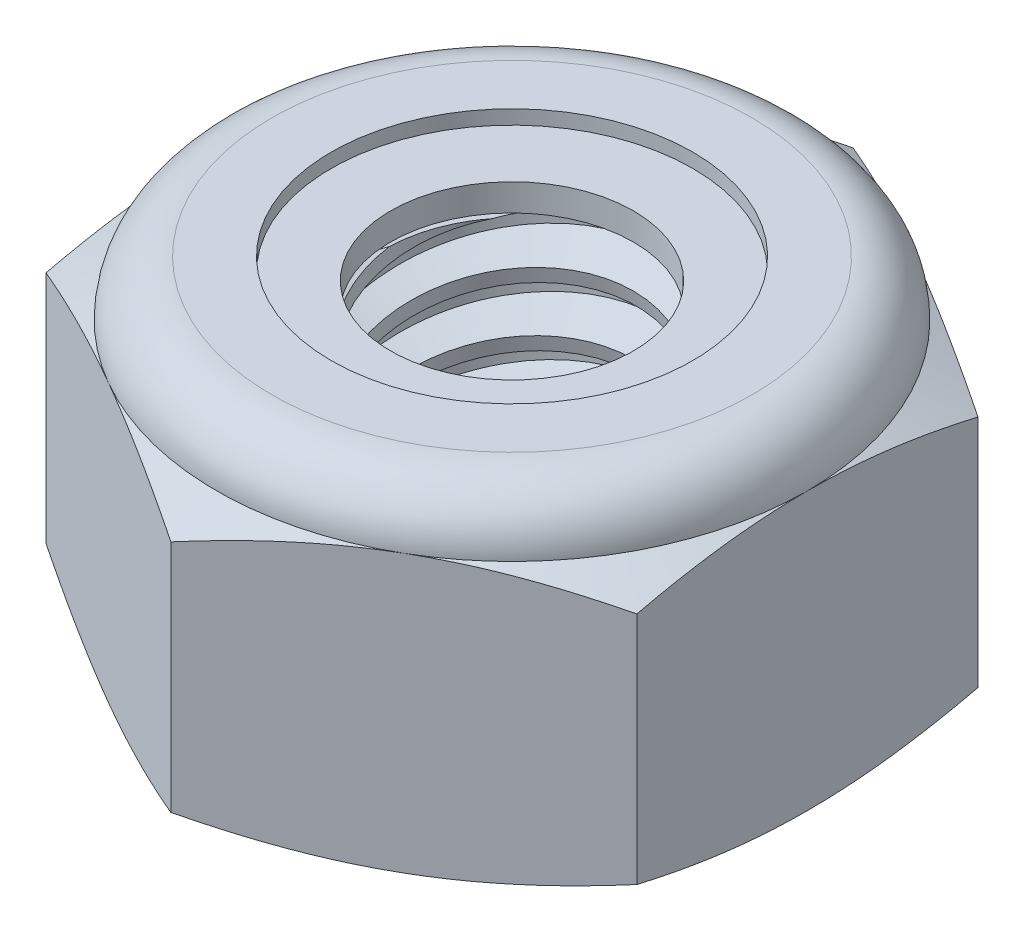
from build123d import *

# Parameters (mm, degrees)
EXTRUDE1_DEPTH       = 3.571875
SKETCH2_W            = 1.5875
SKETCH2_H            = 3.571875
LPATTERN1_COUNT      = 6
LPATTERN1_PITCH      = 0.635
LPATTERN1_COUNT_DIR2 = 2
LPATTERN1_PITCH_DIR2 = 0.635


with BuildPart() as part:
    # Sketch1 → Extrude1 (new body)
    with BuildSketch(Plane(origin=(0, 0, 0), x_dir=(1, 0, 0), z_dir=(0, 1, 0))):
        Polygon((0, 3.666174209), (-3.175, 1.833087105), (-3.175, -1.833087105), (0, -3.666174209), (3.175, -1.833087105), (3.175, 1.833087105), align=None)
    extrude(amount=EXTRUDE1_DEPTH)

    # Sketch4 → Cut-Revolve2 (revolve, cut)
    with BuildSketch(Plane(origin=(0, 0, 0), x_dir=(0, 0, -1), z_dir=(1, 0, 0))):
        Polygon((0, 3.571875), (1.5875, 3.571875), (1.304954178, 3.440121719), (1.304954178, 0.131753281), (1.5875, 0), (0, 0), align=None)
    revolve(axis=Axis((0, 3.571875, 0), (0, 1, 0)), mode=Mode.SUBTRACT)


with BuildPart() as body_2:
    # Sketch2 → Revolve1 (revolve)
    with BuildSketch(Plane(origin=(0, 0, 0), x_dir=(0, 0, -1), z_dir=(1, 0, 0))):
        with Locations((0.79375, 1.7859375)):
            Rectangle(SKETCH2_W, SKETCH2_H)
    revolve(axis=Axis((0, -1.5875, 0), (0, 1, 0)))

    # Sketch3 → Cut-Revolve1 (revolve, cut)
    with BuildSketch(Plane(origin=(0, 0, 0), x_dir=(0, 0, -1), z_dir=(1, 0, 0))):
        Polygon((1.603066718, 3.494041409), (1.712033746, 2.949206271), (1.336087614, 3.076384382), (1.304954178, 3.232051564), align=None)
    cut_revolve1 = revolve(axis=Axis((0, 3.571875, 0.136352241), (0, -0.9805806756909201, -0.1961161351381845)), mode=Mode.SUBTRACT)

    # LPattern1: Cut-Revolve1 6 × 2
    with Locations(*[Vector(0, -1, 0) * (i * LPATTERN1_PITCH) + Vector(0, 1, 0) * (j * LPATTERN1_PITCH_DIR2) for i in range(LPATTERN1_COUNT) for j in range(LPATTERN1_COUNT_DIR2) if (i, j) != (0, 0)]):
        add(cut_revolve1, mode=Mode.SUBTRACT)


with BuildPart() as part_1:
    add(part.part)

    # Combine1: cut body 2
    add(body_2.part, mode=Mode.SUBTRACT)

    # Sketch5 → Cut-Revolve3 (revolve, cut)
    with BuildSketch(Plane(origin=(0, 0, 0), x_dir=(0, 0, -1), z_dir=(1, 0, 0))):
        with BuildLine():
            Line((0, 0), (3.175, 0))
            Line((3.175, 0), (3.666174209, 0.229038295))
            Line((3.666174209, 0.229038295), (3.666174209, 2.747524205))
            Line((3.666174209, 2.747524205), (3.175, 2.9765625))
            ThreePointArc((3.175, 2.9765625), (3.000637006, 3.397512006), (2.5796875, 3.571875))
            Line((2.5796875, 3.571875), (2.5796875, 4.841875))
            Line((2.5796875, 4.841875), (4.936174209, 4.841875))
            Line((4.936174209, 4.841875), (4.936174209, -1.27))
            Line((4.936174209, -1.27), (0, -1.27))
            Line((0, -1.27), (0, 0))
        make_face()
    revolve(axis=Axis((0, 0, 0), (0, 1, 0)), mode=Mode.SUBTRACT)

    # Sketch6 → Cut-Revolve4 (revolve, cut)
    with BuildSketch(Plane(origin=(0, 0, 0), x_dir=(0, 0, -1), z_dir=(1, 0, 0))):
        with BuildLine():
            Line((0, 2.9765625), (3.0226, 2.9765625))
            ThreePointArc((3.0226, 2.9765625), (2.892873932, 3.289748932), (2.5796875, 3.419475))
            Line((2.5796875, 3.419475), (1.942320839, 3.419475))
            Line((1.942320839, 3.419475), (1.942320839, 4.841875))
            Line((1.942320839, 4.841875), (0, 4.841875))
            Line((0, 4.841875), (0, 2.9765625))
        make_face()
    revolve(axis=Axis((0, 4.841875, 0), (0, 1, 0)), mode=Mode.SUBTRACT)


with BuildPart() as body_2_2:
    # Sketch7 → Revolve2 (revolve)
    with BuildSketch(Plane(origin=(0, 0, 0), x_dir=(0, 0, -1), z_dir=(1, 0, 0))):
        with BuildLine():
            Line((1.304954178, 3.0527625), (2.938395763, 3.0527625))
            ThreePointArc((2.938395763, 3.0527625), (2.810484559, 3.261537543), (2.5796875, 3.343275))
            Line((2.5796875, 3.343275), (1.304954178, 3.343275))
            Line((1.304954178, 3.343275), (1.304954178, 3.0527625))
        make_face()
    revolve(axis=Axis((0, 3.0527625, 0), (0, 1, 0)))


solid = Compound([part_1.part, body_2_2.part])
